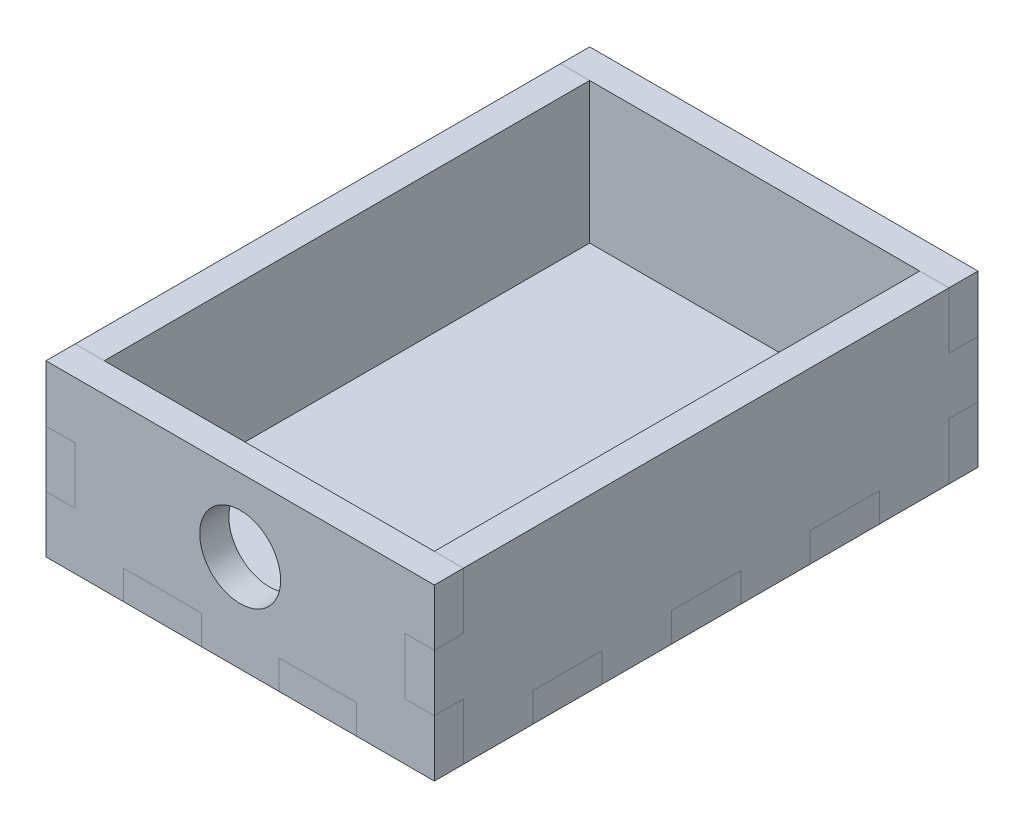
from build123d import *

# Parameters (mm, degrees)
BOSS_EXTRUDE1_DEPTH = 6
SKETCH2_R           = 8.333333333
BOSS_EXTRUDE2_DEPTH = 6
BOSS_EXTRUDE3_DEPTH = 6
BOSS_EXTRUDE6_DEPTH = 6
BOSS_EXTRUDE8_DEPTH = 6
CUT_EXTRUDE8_DEPTH  = 6
CUT_EXTRUDE9_DEPTH  = 6
CUT_EXTRUDE10_DEPTH = 6
CUT_EXTRUDE11_DEPTH = 6


with BuildPart() as part:
    # Sketch1 → Boss-Extrude1 (new body)
    with BuildSketch(Plane(origin=(0, 0, 0), x_dir=(1, 0, 0), z_dir=(0, 1, 0))):
        Polygon((-80, 112), (0, 112), (0, 0), (-80, 0), (-80, 6), (-80, 24.8), (-80, 43.6), (-80, 62.4), (-80, 81.2), (-80, 100), align=None)
    extrude(amount=BOSS_EXTRUDE1_DEPTH)


with BuildPart() as body_2:
    # Sketch2 → Boss-Extrude2 (new body)
    with BuildSketch(Plane.XY):
        Polygon((-80, 0), (-64, 0), (-64, 6), (-48, 6), (-48, 0), (-32, 0), (-32, 6), (-16, 6), (-16, 0), (0, 0), (0, 11.666666667), (-6, 11.666666667), (-6, 23.333333333), (0, 23.333333333), (0, 35), (-80, 35), (-80, 23.333333333), (-74, 23.333333333), (-74, 11.666666667), (-80, 11.666666667), align=None)
        with Locations((-40, 20)):
            Circle(SKETCH2_R, mode=Mode.SUBTRACT)
    extrude(amount=-BOSS_EXTRUDE2_DEPTH)


with BuildPart() as body_3:
    # Sketch3 → Boss-Extrude3 (new body)
    with BuildSketch(Plane.ZY.offset(80)):
        Polygon((0, 6), (-6, 6), (-6, 0), (-20.285714286, 0), (-20.285714286, 6), (-34.571428571, 6), (-34.571428571, 0), (-48.857142857, 0), (-48.857142857, 6), (-63.142857143, 6), (-63.142857143, 0), (-77.428571429, 0), (-77.428571429, 6), (-91.714285714, 6), (-91.714285714, 0), (-106, 0), (-106, 6), (-112, 6), (-112, 35), (0, 35), align=None)
    extrude(amount=-BOSS_EXTRUDE3_DEPTH)


with BuildPart() as body_4:
    # Sketch9 → Boss-Extrude6 (new body)
    with BuildSketch(Plane(origin=(0, 0, -112), x_dir=(-1, 0, 0), z_dir=(0, 0, -1))):
        Polygon((80, 0), (80, 11.666666667), (74, 11.666666667), (74, 23.333333333), (80, 23.333333333), (80, 35), (0, 35), (0, 23.333333333), (6, 23.333333333), (6, 11.666666667), (0, 11.666666667), (0, 0), (16, 0), (16, 6), (32, 6), (32, 0), (48, 0), (48, 6), (64, 6), (64, 0), align=None)
    extrude(amount=-BOSS_EXTRUDE6_DEPTH)


with BuildPart() as body_5:
    # Sketch17 → Boss-Extrude8 (new body)
    with BuildSketch(Plane(origin=(0, 0, 0), x_dir=(0, 0, -1), z_dir=(1, 0, 0))):
        Polygon((112, 6), (112, 35), (0, 35), (0, 6), (6, 6), (6, 0), (20.285714286, 0), (20.285714286, 6), (34.571428571, 6), (34.571428571, 0), (48.857142857, 0), (48.857142857, 6), (63.142857143, 6), (63.142857143, 0), (77.428571429, 0), (77.428571429, 6), (91.714285714, 6), (91.714285714, 0), (106, 0), (106, 6), align=None)
    extrude(amount=-BOSS_EXTRUDE8_DEPTH)


with BuildPart() as cut_extrude8_tool:
    # Sketch18 → Cut-Extrude8 (new body)
    with BuildSketch(Plane.XY):
        Polygon((-80, 11.666666667), (-80, 0), (-64, 0), (-64, 6), (-48, 6), (-48, 0), (-32, 0), (-32, 6), (-16, 6), (-16, 0), (0, 0), (0, 11.666666667), (-6, 11.666666667), (-6, 23.333333333), (0, 23.333333333), (0, 35), (-80, 35), (-80, 23.333333333), (-74, 23.333333333), (-74, 11.666666667), align=None)
    extrude(amount=-CUT_EXTRUDE8_DEPTH)


with BuildPart() as body_5_1:
    add(body_5.part)

    # Cut-Extrude8: cut by cut_extrude8_tool
    add(cut_extrude8_tool.part, mode=Mode.SUBTRACT)


with BuildPart() as part_1:
    add(part.part)

    # Cut-Extrude8: cut by cut_extrude8_tool
    add(cut_extrude8_tool.part, mode=Mode.SUBTRACT)


with BuildPart() as body_3_1:
    add(body_3.part)

    # Cut-Extrude8: cut by cut_extrude8_tool
    add(cut_extrude8_tool.part, mode=Mode.SUBTRACT)


with BuildPart() as cut_extrude9_tool:
    # Sketch19 → Cut-Extrude9 (new body)
    with BuildSketch(Plane(origin=(0, 0, -112), x_dir=(-1, 0, 0), z_dir=(0, 0, -1))):
        Polygon((64, 0), (80, 0), (80, 11.666666667), (74, 11.666666667), (74, 23.333333333), (80, 23.333333333), (80, 35), (0, 35), (0, 23.333333333), (6, 23.333333333), (6, 11.666666667), (0, 11.666666667), (0, 0), (16, 0), (16, 6), (32, 6), (32, 0), (48, 0), (48, 6), (64, 6), align=None)
    extrude(amount=-CUT_EXTRUDE9_DEPTH)


with BuildPart() as part_2:
    add(part_1.part)

    # Cut-Extrude9: cut by cut_extrude9_tool
    add(cut_extrude9_tool.part, mode=Mode.SUBTRACT)

    # Sketch20 → Cut-Extrude10 (cut)
    with BuildSketch(Plane(origin=(0, 0, 0), x_dir=(0, 0, -1), z_dir=(1, 0, 0))):
        Polygon((106, 11.666666667), (112, 11.666666667), (112, 23.333333333), (106, 23.333333333), (106, 35), (6, 35), (6, 23.333333333), (0, 23.333333333), (0, 11.666666667), (6, 11.666666667), (6, 0), (20.285714286, 0), (20.285714286, 6), (34.571428571, 6), (34.571428571, 0), (48.857142857, 0), (48.857142857, 6), (63.142857143, 6), (63.142857143, 0), (77.428571429, 0), (77.428571429, 6), (91.714285714, 6), (91.714285714, 0), (106, 0), align=None)
    extrude(amount=-CUT_EXTRUDE10_DEPTH, mode=Mode.SUBTRACT)

    # Sketch21 → Cut-Extrude11 (cut)
    with BuildSketch(Plane.ZY.offset(80)):
        Polygon((-112, 23.333333333), (-112, 11.666666667), (-106, 11.666666667), (-106, 0), (-91.714285714, 0), (-91.714285714, 6), (-77.428571429, 6), (-77.428571429, 0), (-63.142857143, 0), (-63.142857143, 6), (-48.857142857, 6), (-48.857142857, 0), (-34.571428571, 0), (-34.571428571, 6), (-20.285714286, 6), (-20.285714286, 0), (-6, 0), (-6, 11.666666667), (0, 11.666666667), (0, 23.333333333), (-6, 23.333333333), (-6, 35), (-106, 35), (-106, 23.333333333), align=None)
    extrude(amount=-CUT_EXTRUDE11_DEPTH, mode=Mode.SUBTRACT)


with BuildPart() as body_5_2:
    add(body_5_1.part)

    # Cut-Extrude9: cut by cut_extrude9_tool
    add(cut_extrude9_tool.part, mode=Mode.SUBTRACT)


with BuildPart() as body_3_2:
    add(body_3_1.part)

    # Cut-Extrude9: cut by cut_extrude9_tool
    add(cut_extrude9_tool.part, mode=Mode.SUBTRACT)


solid = Compound([body_2.part, body_4.part, part_2.part, body_5_2.part, body_3_2.part])
